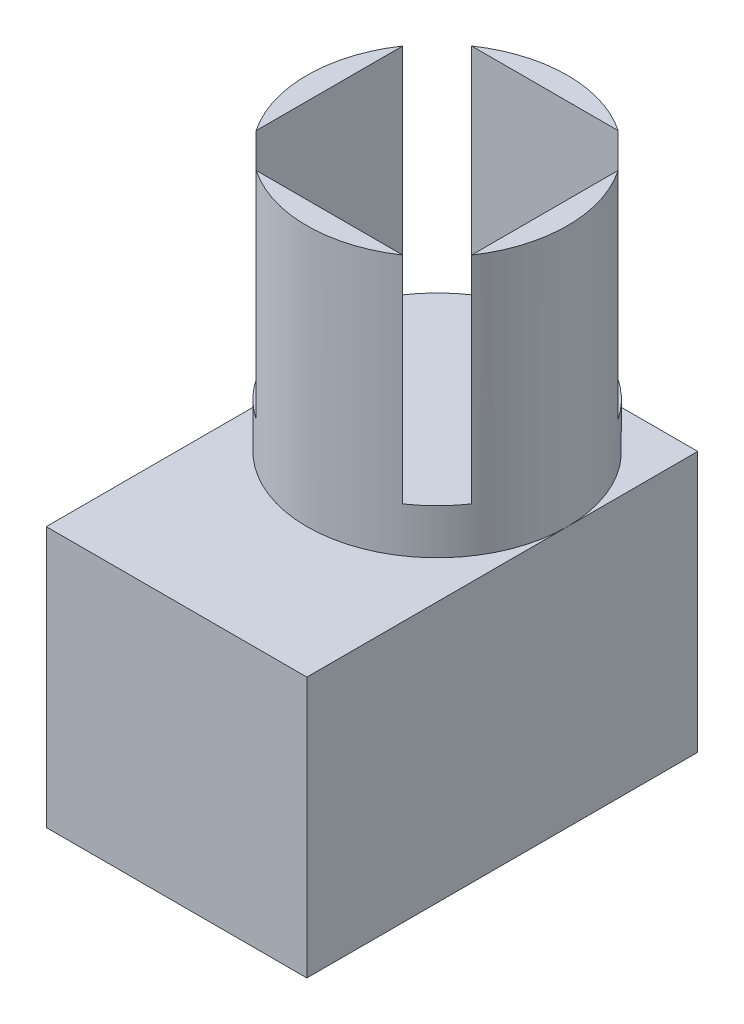
from build123d import *

# Parameters (mm, degrees)
SKETCH1_R           = 25.4
BOSS_EXTRUDE1_DEPTH = 101.6
SKETCH2_W           = 42.0116
SKETCH2_H           = 42.0116
CUT_EXTRUDE1_DEPTH  = 42.0116
SKETCH3_W           = 50.8
SKETCH3_H           = 76.2
BOSS_EXTRUDE2_DEPTH = 50.8
SKETCH4_W           = 43.18
SKETCH4_H           = 68.58
CUT_EXTRUDE2_DEPTH  = 44.45
CUT_EXTRUDE3_REACH  = 126.434
SKETCH5_W           = 9.398
SKETCH5_H           = 11.43


with BuildPart() as part:
    # Sketch1 → Boss-Extrude1 (new body)
    with BuildSketch(Plane(origin=(0, 0, 0), x_dir=(1, 0, 0), z_dir=(0, 1, 0))):
        with Locations(Location((0, 0, 0), (0, 0, 270))):
            Circle(SKETCH1_R)
    extrude(amount=BOSS_EXTRUDE1_DEPTH)

    # Sketch2 → Cut-Extrude1 (cut)
    with BuildSketch(Plane(origin=(0, 101.6, 0), x_dir=(1, 0, 0), z_dir=(0, 1, 0))):
        Rectangle(SKETCH2_W, SKETCH2_H)
    extrude(amount=-CUT_EXTRUDE1_DEPTH, mode=Mode.SUBTRACT)

    # Sketch3 → Boss-Extrude2 (add)
    with BuildSketch(Plane.XZ):
        with Locations((0, 12.7)):
            Rectangle(SKETCH3_W, SKETCH3_H)
    extrude(amount=-BOSS_EXTRUDE2_DEPTH)

    # Sketch4 → Cut-Extrude2 (cut)
    with BuildSketch(Plane.XZ):
        with Locations((0, 12.7)):
            Rectangle(SKETCH4_W, SKETCH4_H)
    extrude(amount=-CUT_EXTRUDE2_DEPTH, mode=Mode.SUBTRACT)

    # Sketch5 → Cut-Extrude3 (cut, up to next)
    with BuildSketch(Plane.ZY.offset(25.4), mode=Mode.PRIVATE) as cut_extrude3_sk1:
        with Locations((-10.541, 10.795)):
            Rectangle(SKETCH5_W, SKETCH5_H)
    cut_extrude3_tool1 = extrude(cut_extrude3_sk1.sketch, amount=-CUT_EXTRUDE3_REACH, mode=Mode.PRIVATE) & part.part
    add(cut_extrude3_tool1.solids().sort_by_distance((-25.4, 10.795, -10.541))[0], mode=Mode.SUBTRACT)


solid = part.part
